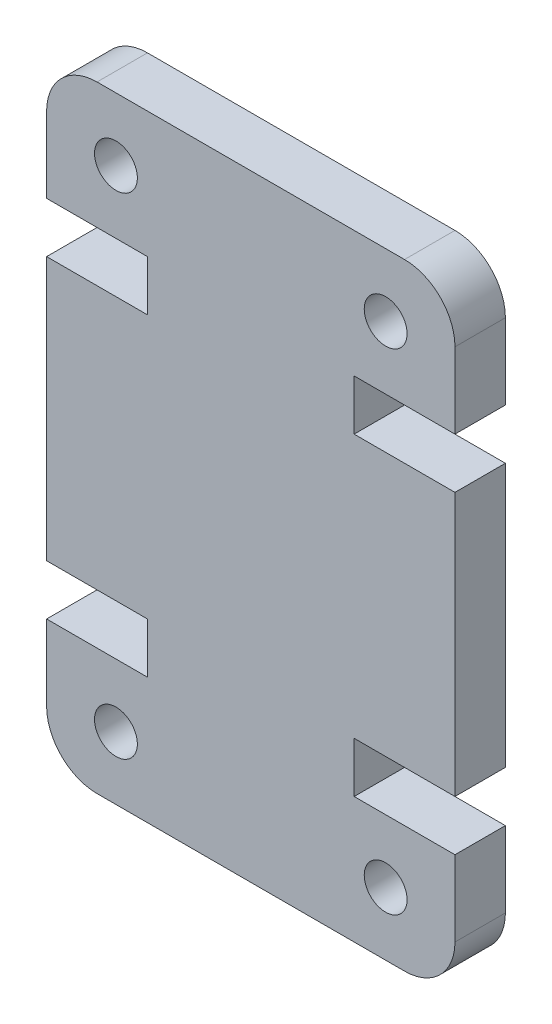
from build123d import *

# Parameters (mm, degrees)
SKETCH1_R           = 0.85
BOSS_EXTRUDE1_DEPTH = 4
SKETCH2_W           = 16.2
SKETCH2_H           = 24.45
CUT_EXTRUDE1_DEPTH  = 2


with BuildPart() as part:
    # Sketch1 → Boss-Extrude1 (new body)
    with BuildSketch(Plane.XY):
        with BuildLine():
            Line((0, 17.45), (0, 7))
            Line((0, 7), (4, 7))
            Line((4, 7), (4, 5))
            Line((4, 5), (0, 5))
            Line((0, 5), (0, 2))
            ThreePointArc((0, 2), (0.585786438, 0.585786438), (2, 0))
            Line((2, 0), (14.2, 0))
            ThreePointArc((14.2, 0), (15.614213562, 0.585786438), (16.2, 2))
            Line((16.2, 2), (16.2, 5))
            Line((16.2, 5), (12.2, 5))
            Line((12.2, 5), (12.2, 7))
            Line((12.2, 7), (16.2, 7))
            Line((16.2, 7), (16.2, 17.45))
            Line((16.2, 17.45), (12.2, 17.45))
            Line((12.2, 17.45), (12.2, 19.45))
            Line((12.2, 19.45), (16.2, 19.45))
            Line((16.2, 19.45), (16.2, 22.45))
            ThreePointArc((16.2, 22.45), (15.614213562, 23.864213562), (14.2, 24.45))
            Line((14.2, 24.45), (2, 24.45))
            ThreePointArc((2, 24.45), (0.585786438, 23.864213562), (0, 22.45))
            Line((0, 22.45), (0, 19.45))
            Line((0, 19.45), (4, 19.45))
            Line((4, 19.45), (4, 17.45))
            Line((4, 17.45), (0, 17.45))
        make_face()
        with Locations(Location((13.45, 2.5, 0), (0, 0, 180))):
            Circle(SKETCH1_R, mode=Mode.SUBTRACT)
        with Locations(Location((2.75, 21.95, 0), (0, 0, 180))):
            Circle(SKETCH1_R, mode=Mode.SUBTRACT)
        with Locations((2.75, 2.5)):
            Circle(SKETCH1_R, mode=Mode.SUBTRACT)
        with Locations((13.45, 21.95)):
            Circle(SKETCH1_R, mode=Mode.SUBTRACT)
    extrude(amount=BOSS_EXTRUDE1_DEPTH)

    # Sketch2 → Cut-Extrude1 (cut)
    with BuildSketch(Plane(origin=(0, 0, 0), x_dir=(-1, 0, 0), z_dir=(0, 0, -1))):
        with Locations((-8.1, 12.225)):
            Rectangle(SKETCH2_W, SKETCH2_H)
    extrude(amount=-CUT_EXTRUDE1_DEPTH, mode=Mode.SUBTRACT)


solid = part.part
